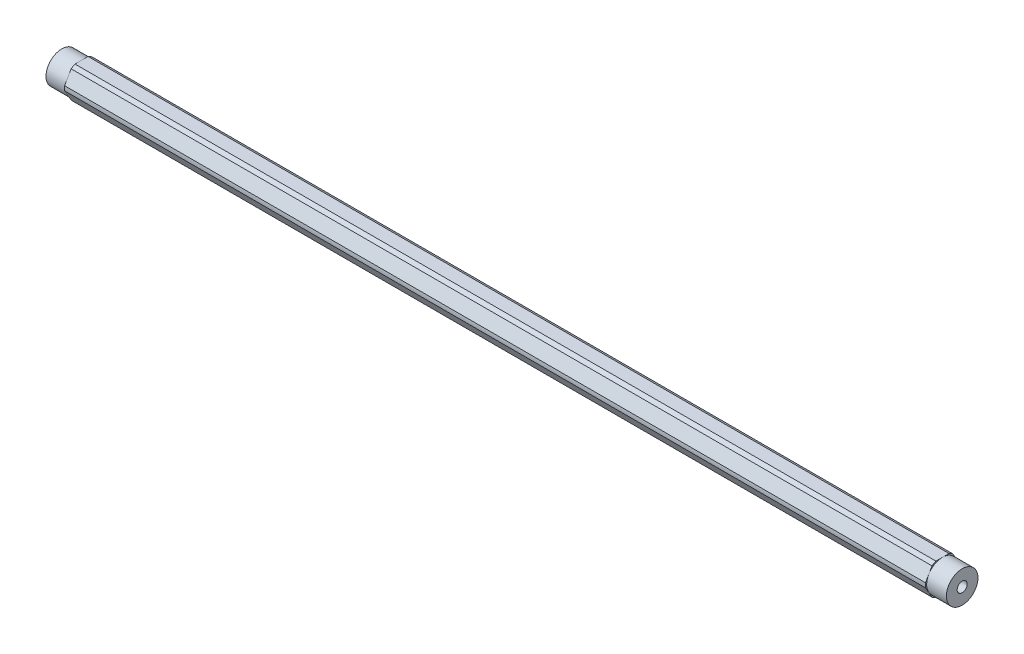
from build123d import *

# Parameters (mm, degrees)
SKETCH1_R                            = 2.0193
BOSS_EXTRUDE1_DEPTH                  = 180.9496
F_10_32_TAPPED_HOLE1_D               = 4.0386
F_10_32_TAPPED_HOLE1_DEPTH           = 16.34744
F_10_32_TAPPED_HOLE1_TIP             = 1.213317848
F_10_32_TAPPED_HOLE1_ON_FACE_2_D     = 4.0386
F_10_32_TAPPED_HOLE1_ON_FACE_2_DEPTH = 16.34744
F_10_32_TAPPED_HOLE1_ON_FACE_2_TIP   = 1.213317848
SKETCH3_R                            = 8.89
SKETCH3_R_2                          = 6.35
CUT_EXTRUDE_THIN1_DEPTH              = 7.9375


with BuildPart() as part:
    # Sketch1 → Boss-Extrude1 (new, symmetric)
    with BuildSketch(Plane(origin=(0, 0, 0), x_dir=(0, 0, -1), z_dir=(1, 0, 0))):
        with BuildLine():
            ThreePointArc((4.181770846, 5.456960429), (3.437499983, 5.953924622), (2.634980936, 6.35))
            Line((2.634980936, 6.35), (-2.634980936, 6.35))
            ThreePointArc((-2.634980936, 6.35), (-3.437499983, 5.953924622), (-4.181770846, 5.456960429))
            Line((-4.181770846, 5.456960429), (-6.816751782, 0.893039571))
            ThreePointArc((-6.816751782, 0.893039571), (-6.874999966, 0), (-6.816751782, -0.893039571))
            Line((-6.816751782, -0.893039571), (-4.181770846, -5.456960429))
            ThreePointArc((-4.181770846, -5.456960429), (-3.437499983, -5.953924622), (-2.634980936, -6.35))
            Line((-2.634980936, -6.35), (2.634980936, -6.35))
            ThreePointArc((2.634980936, -6.35), (3.437499983, -5.953924622), (4.181770846, -5.456960429))
            Line((4.181770846, -5.456960429), (6.816751782, -0.893039571))
            ThreePointArc((6.816751782, -0.893039571), (6.860422465, -0.447468582), (6.874999966, 0))
            ThreePointArc((6.874999966, 0), (6.860422465, 0.447468582), (6.816751782, 0.893039571))
            Line((6.816751782, 0.893039571), (4.181770846, 5.456960429))
        make_face()
        Circle(SKETCH1_R, mode=Mode.SUBTRACT)
    extrude(amount=BOSS_EXTRUDE1_DEPTH, both=True)

    # #10-32 Tapped Hole1
    with Locations(Plane(origin=(180.9496, 0, 0), x_dir=(0, 0, 1), z_dir=(1, 0, 0))):
        with Locations((0, 0)):
            Hole(F_10_32_TAPPED_HOLE1_D / 2, depth=F_10_32_TAPPED_HOLE1_DEPTH)
            with Locations((0, 0, -(F_10_32_TAPPED_HOLE1_DEPTH + F_10_32_TAPPED_HOLE1_TIP / 2))):  # 118° drill point
                Cone(0, F_10_32_TAPPED_HOLE1_D / 2, F_10_32_TAPPED_HOLE1_TIP, mode=Mode.SUBTRACT)

    # #10-32 Tapped Hole1 on face 2
    with Locations(Plane(origin=(-180.9496, 0, 0), x_dir=(0, 0, 1), z_dir=(1, 0, 0))):
        with Locations((0, 0)):
            Hole(F_10_32_TAPPED_HOLE1_ON_FACE_2_D / 2, depth=F_10_32_TAPPED_HOLE1_ON_FACE_2_DEPTH)
            with Locations((0, 0, -(F_10_32_TAPPED_HOLE1_ON_FACE_2_DEPTH + F_10_32_TAPPED_HOLE1_ON_FACE_2_TIP / 2))):  # 118° drill point
                Cone(0, F_10_32_TAPPED_HOLE1_ON_FACE_2_D / 2, F_10_32_TAPPED_HOLE1_ON_FACE_2_TIP, mode=Mode.SUBTRACT)

    # Sketch3 → Cut-Extrude-Thin1 (cut)
    with BuildSketch(Plane(origin=(180.9496, 0, 0), x_dir=(0, 0, -1), z_dir=(1, 0, 0))):
        Circle(SKETCH3_R)
        Circle(SKETCH3_R_2, mode=Mode.SUBTRACT)
    cut_extrude_thin1 = extrude(amount=-CUT_EXTRUDE_THIN1_DEPTH, mode=Mode.SUBTRACT)

    # Mirror1: Cut-Extrude-Thin1 across plane
    add(cut_extrude_thin1.mirror(Plane(origin=(0, 0, 0), x_dir=(0, 0, 1), z_dir=(1, 0, 0))), mode=Mode.SUBTRACT)


solid = part.part
